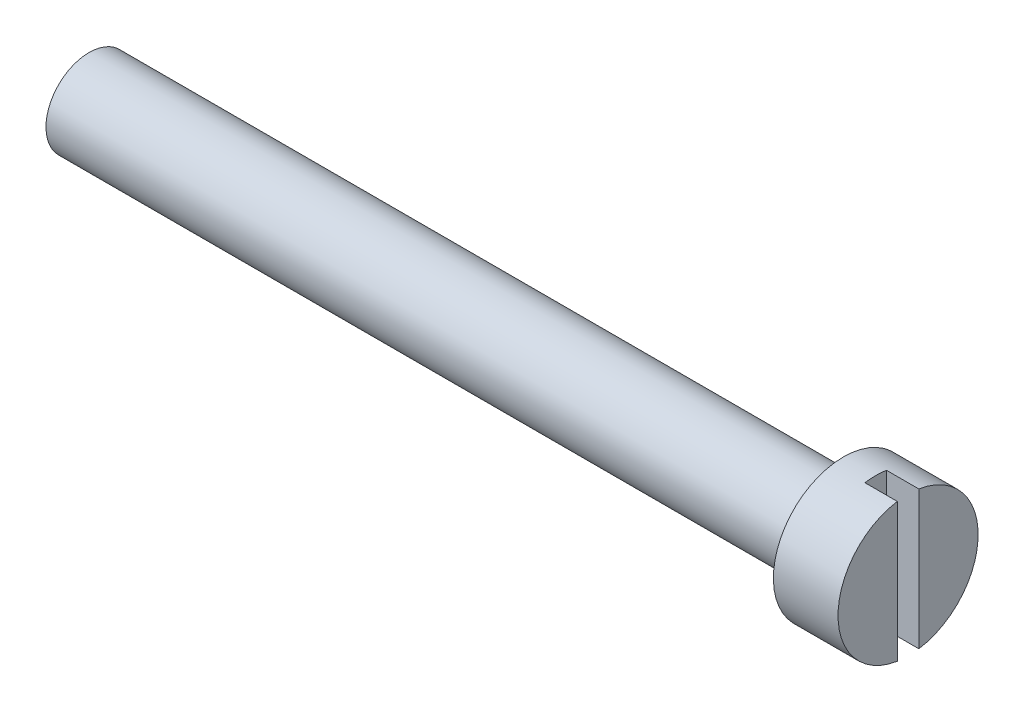
from build123d import *

# Parameters (mm, degrees)
SKETCH2_W          = 1
SKETCH2_H          = 6.5
CUT_EXTRUDE1_DEPTH = 1.5


with BuildPart() as part:
    # Sketch1 → Revolve1 (revolve)
    with BuildSketch(Plane.XY):
        Polygon((0, 0), (-38, 0), (-38, 2), (-3, 2), (-3, 3.25), (0, 3.25), align=None)
    revolve(axis=Axis((0, 0, 0), (-1, 0, 0)))

    # Sketch2 → Cut-Extrude1 (cut)
    with BuildSketch(Plane(origin=(0, 0, 0), x_dir=(0, 0, -1), z_dir=(1, 0, 0))):
        Rectangle(SKETCH2_W, SKETCH2_H)
    extrude(amount=-CUT_EXTRUDE1_DEPTH, mode=Mode.SUBTRACT)


solid = part.part
